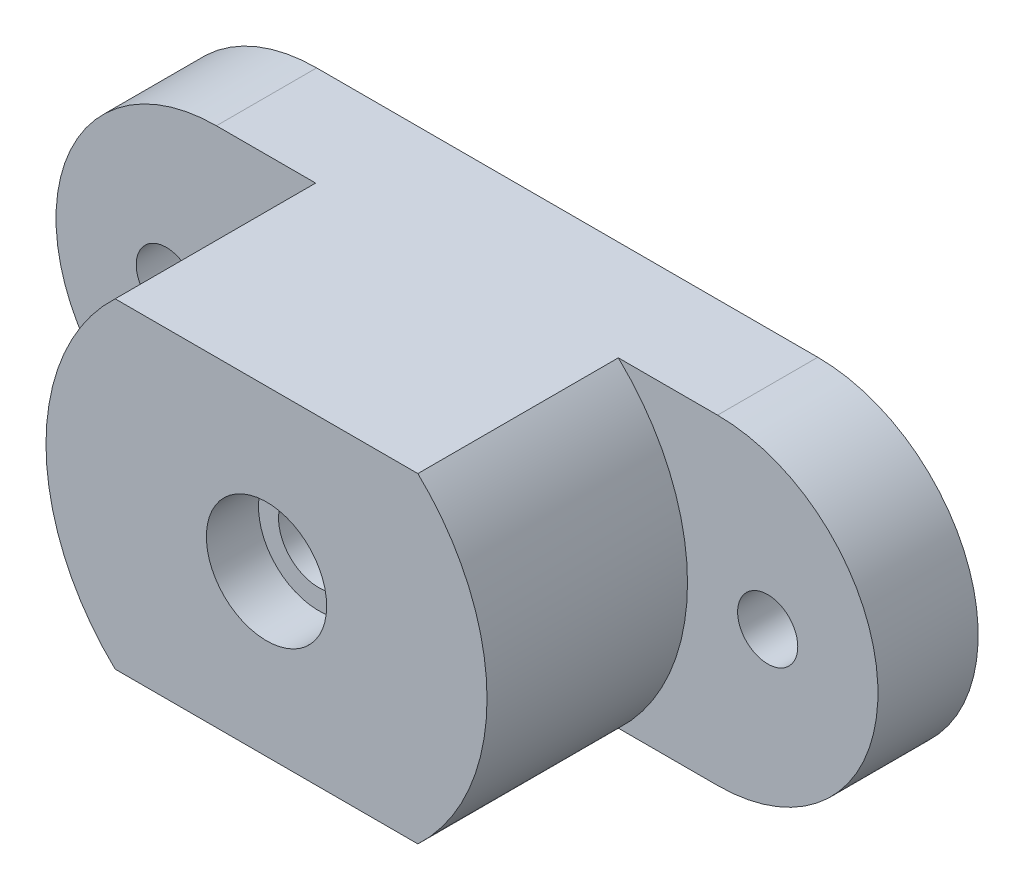
from build123d import *

# Parameters (mm, degrees)
EXTRUDE_1_DEPTH     = 5
EXTRUDE_2_DEPTH     = 10
SKETCH_3_R          = 3
CUT_EXTRUDE_1_DEPTH = 2.6
SKETCH_4_R          = 2
CUT_EXTRUDE_2_DEPTH = 37.149135536
SKETCH_5_R          = 6
CUT_EXTRUDE_3_DEPTH = 10
SKETCH_6_R          = 1.5
CUT_EXTRUDE_4_DEPTH = 36.397740041


with BuildPart() as part:
    # 草图1 → 凸台-拉伸1 (new body)
    with BuildSketch(Plane.XY):
        with BuildLine():
            Line((0, 8), (25, 8))
            ThreePointArc((25, 8), (33, 0), (25, -8))
            Line((25, -8), (0, -8))
            ThreePointArc((0, -8), (-8, 0), (0, 8))
        make_face()
    extrude(amount=EXTRUDE_1_DEPTH)

    # 草图2 → 凸台-拉伸2 (add)
    with BuildSketch(Plane.XY.offset(5)):
        with BuildLine():
            Line((4.950165565, -8), (20.049834435, -8))
            ThreePointArc((20.049834435, -8), (23.5, 0), (20.049834435, 8))
            Line((20.049834435, 8), (4.950165565, 8))
            ThreePointArc((4.950165565, 8), (1.5, 0), (4.950165565, -8))
        make_face()
    extrude(amount=EXTRUDE_2_DEPTH)

    # 草图3 → 切除-拉伸1 (cut)
    with BuildSketch(Plane.XY.offset(15)):
        with Locations((12.5, 0)):
            Circle(SKETCH_3_R)
    extrude(amount=-CUT_EXTRUDE_1_DEPTH, mode=Mode.SUBTRACT)

    # 草图4 → 切除-拉伸2 (cut, through all)
    with BuildSketch(Plane.XY.offset(12.4)):
        with Locations((12.5, 0)):
            Circle(SKETCH_4_R)
    extrude(amount=-CUT_EXTRUDE_2_DEPTH, mode=Mode.SUBTRACT)

    # 草图5 → 切除-拉伸3 (cut)
    with BuildSketch(Plane(origin=(0, 0, 0), x_dir=(-1, 0, 0), z_dir=(0, 0, -1))):
        with Locations((-12.5, 0)):
            Circle(SKETCH_5_R)
    extrude(amount=-CUT_EXTRUDE_3_DEPTH, mode=Mode.SUBTRACT)

    # 草图6 → 切除-拉伸4 (cut, through all)
    with BuildSketch(Plane.XY.offset(5)):
        with Locations((-2.5, 0)):
            Circle(SKETCH_6_R)
        with Locations((27.5, 0)):
            Circle(SKETCH_6_R)
    extrude(amount=-CUT_EXTRUDE_4_DEPTH, mode=Mode.SUBTRACT)


solid = part.part
